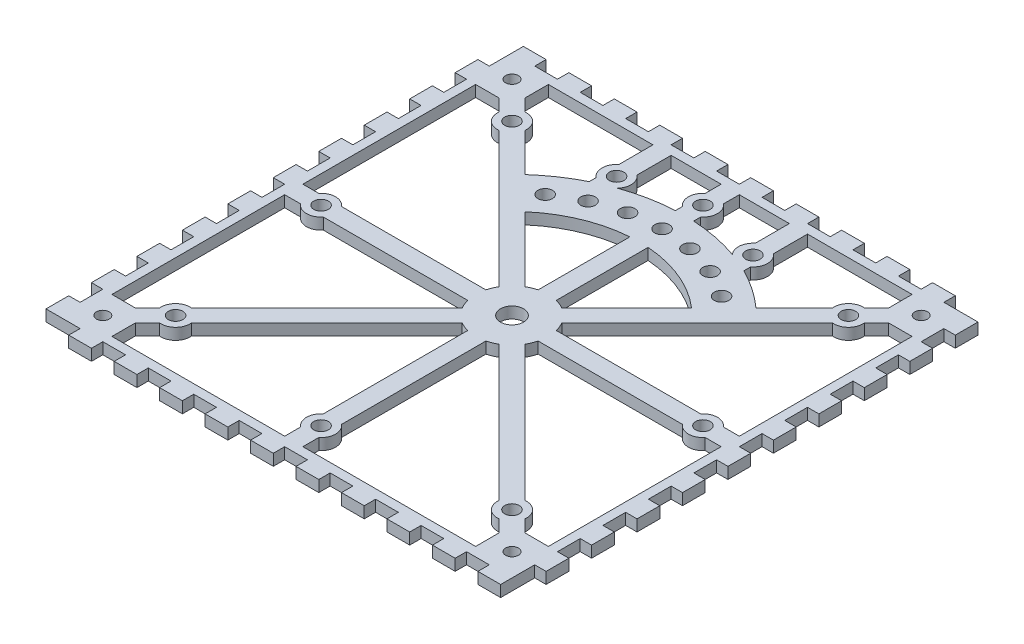
from build123d import *

# Parameters (mm, degrees)
SKETCH1_R           = 2.55
SKETCH1_R_2         = 1.6
SKETCH1_R_3         = 1.4
BOSS_EXTRUDE1_DEPTH = 2.5


with BuildPart() as part:
    # Sketch1 → Boss-Extrude1 (new body)
    with BuildSketch(Plane(origin=(0, 0, 0), x_dir=(1, 0, 0), z_dir=(0, 1, 0))):
        Polygon((-50, 50), (-50, 52.5), (-45, 52.5), (-45, 50), (-40, 50), (-40, 52.5), (-35, 52.5), (-35, 50), (-30, 50), (-30, 52.5), (-25, 52.5), (-25, 50), (-20, 50), (-20, 52.5), (-15, 52.5), (-15, 50), (-10, 50), (-10, 52.5), (-5, 52.5), (-5, 50), (0, 50), (0, 52.5), (5, 52.5), (5, 50), (10, 50), (10, 52.5), (15, 52.5), (15, 50), (20, 50), (20, 52.5), (25, 52.5), (25, 50), (30, 50), (30, 52.5), (35, 52.5), (35, 50), (40, 50), (40, 52.5), (45, 52.5), (45, 50), (50, 50), (52.5, 50), (52.5, 45), (50, 45), (50, 40), (52.5, 40), (52.5, 35), (50, 35), (50, 30), (52.5, 30), (52.5, 25), (50, 25), (50, 20), (52.5, 20), (52.5, 15), (50, 15), (50, 10), (52.5, 10), (52.5, 5), (50, 5), (50, 0), (52.5, 0), (52.5, -5), (50, -5), (50, -10), (52.5, -10), (52.5, -15), (50, -15), (50, -20), (52.5, -20), (52.5, -25), (50, -25), (50, -30), (52.5, -30), (52.5, -35), (50, -35), (50, -40), (52.5, -40), (52.5, -45), (50, -45), (50, -50), (50, -52.5), (45, -52.5), (45, -50), (40, -50), (40, -52.5), (35, -52.5), (35, -50), (30, -50), (30, -52.5), (25, -52.5), (25, -50), (20, -50), (20, -52.5), (15, -52.5), (15, -50), (10, -50), (10, -52.5), (5, -52.5), (5, -50), (0, -50), (0, -52.5), (-5, -52.5), (-5, -50), (-10, -50), (-10, -52.5), (-15, -52.5), (-15, -50), (-20, -50), (-20, -52.5), (-25, -52.5), (-25, -50), (-30, -50), (-30, -52.5), (-35, -52.5), (-35, -50), (-40, -50), (-40, -52.5), (-45, -52.5), (-45, -50), (-50, -50), (-52.5, -50), (-52.5, -45), (-50, -45), (-50, -40), (-52.5, -40), (-52.5, -35), (-50, -35), (-50, -30), (-52.5, -30), (-52.5, -25), (-50, -25), (-50, -20), (-52.5, -20), (-52.5, -15), (-50, -15), (-50, -10), (-52.5, -10), (-52.5, -5), (-50, -5), (-50, 0), (-52.5, 0), (-52.5, 5), (-50, 5), (-50, 10), (-52.5, 10), (-52.5, 15), (-50, 15), (-50, 20), (-52.5, 20), (-52.5, 25), (-50, 25), (-50, 30), (-52.5, 30), (-52.5, 35), (-50, 35), (-50, 40), (-52.5, 40), (-52.5, 45), (-50, 45), align=None)
        with Locations(Location((0, 0, 0), (0, 0, 270))):
            Circle(SKETCH1_R, mode=Mode.SUBTRACT)
        with Locations(Location((37, -37, 0), (0, 0, 270))):
            Circle(SKETCH1_R_2, mode=Mode.SUBTRACT)
        with Locations(Location((-37, -37, 0), (0, 0, 270))):
            Circle(SKETCH1_R_2, mode=Mode.SUBTRACT)
        with Locations(Location((-37, 37, 0), (0, 0, 270))):
            Circle(SKETCH1_R_2, mode=Mode.SUBTRACT)
        with Locations(Location((37, 37, 0), (0, 0, 270))):
            Circle(SKETCH1_R_2, mode=Mode.SUBTRACT)
        with Locations(Location((0, 42, 0), (0, 0, 270))):
            Circle(SKETCH1_R_2, mode=Mode.SUBTRACT)
        with Locations(Location((42, 0, 0), (0, 0, 270))):
            Circle(SKETCH1_R_2, mode=Mode.SUBTRACT)
        with Locations(Location((-42, 0, 0), (0, 0, 270))):
            Circle(SKETCH1_R_2, mode=Mode.SUBTRACT)
        with Locations(Location((0, -42, 0), (0, 0, 270))):
            Circle(SKETCH1_R_2, mode=Mode.SUBTRACT)
        with Locations(Location((-45, 45, 0), (0, 0, 270))):
            Circle(SKETCH1_R_3, mode=Mode.SUBTRACT)
        with Locations(Location((45, 45, 0), (0, 0, 270))):
            Circle(SKETCH1_R_3, mode=Mode.SUBTRACT)
        with Locations(Location((-45, -45, 0), (0, 0, 270))):
            Circle(SKETCH1_R_3, mode=Mode.SUBTRACT)
        with Locations(Location((45, -45, 0), (0, 0, 270))):
            Circle(SKETCH1_R_3, mode=Mode.SUBTRACT)
        with Locations(Location((-15, 38, 0), (0, 0, 270))):
            Circle(SKETCH1_R_2, mode=Mode.SUBTRACT)
        with Locations(Location((15, 38, 0), (0, 0, 270))):
            Circle(SKETCH1_R_2, mode=Mode.SUBTRACT)
        with Locations(Location((0, 33, 0), (0, 0, 270))):
            Circle(SKETCH1_R_2, mode=Mode.SUBTRACT)
        with Locations(Location((6.861085797, 32.278870824, 0), (0, 0, 270))):
            Circle(SKETCH1_R_2, mode=Mode.SUBTRACT)
        with Locations(Location((13.422309222, 30.147000102, 0), (0, 0, 270))):
            Circle(SKETCH1_R_2, mode=Mode.SUBTRACT)
        with Locations(Location((19.396913326, 26.697560814, 0), (0, 0, 270))):
            Circle(SKETCH1_R_2, mode=Mode.SUBTRACT)
        with Locations(Location((-19.396913326, 26.697560814, 0), (0, 0, 270))):
            Circle(SKETCH1_R_2, mode=Mode.SUBTRACT)
        with Locations(Location((-13.422309221, 30.147000102, 0), (0, 0, 270))):
            Circle(SKETCH1_R_2, mode=Mode.SUBTRACT)
        with Locations(Location((-6.861085797, 32.278870824, 0), (0, 0, 270))):
            Circle(SKETCH1_R_2, mode=Mode.SUBTRACT)
        with BuildLine():
            Line((-40, 48), (-17, 48))
            Line((-17, 48), (-17, 40.497999199))
            ThreePointArc((-17, 40.497999199), (-18.2, 38), (-17, 35.502000801))
            Line((-17, 35.502000801), (-17, 33.985290936))
            ThreePointArc((-17, 33.985290936), (-21.402484999, 31.399580186), (-25.418602168, 28.247029292))
            Line((-25.418602168, 28.247029292), (-33.819434264, 36.647861389))
            ThreePointArc((-33.819434264, 36.647861389), (-34.7372583, 39.2627417), (-37.352138611, 40.180565736))
            Line((-37.352138611, 40.180565736), (-40, 42.828427125))
            Line((-40, 42.828427125), (-40, 48))
        make_face(mode=Mode.SUBTRACT)
        with BuildLine():
            Line((-48, 40), (-48, 2))
            Line((-48, 2), (-44.497999199, 2))
            ThreePointArc((-44.497999199, 2), (-42, 3.2), (-39.502000801, 2))
            Line((-39.502000801, 2), (-7.745966692, 2))
            ThreePointArc((-7.745966692, 2), (-7.39103626, 3.061467459), (-6.891439137, 4.063012013))
            Line((-6.891439137, 4.063012013), (-36.647861389, 33.819434264))
            ThreePointArc((-36.647861389, 33.819434264), (-39.2627417, 34.7372583), (-40.180565736, 37.352138611))
            Line((-40.180565736, 37.352138611), (-42.828427125, 40))
            Line((-42.828427125, 40), (-48, 40))
        make_face(mode=Mode.SUBTRACT)
        with BuildLine():
            Line((-40, -48), (-2, -48))
            Line((-2, -48), (-2, -44.497999199))
            ThreePointArc((-2, -44.497999199), (-3.2, -42), (-2, -39.502000801))
            Line((-2, -39.502000801), (-2, -7.745966692))
            ThreePointArc((-2, -7.745966692), (-3.061467459, -7.39103626), (-4.063012013, -6.891439137))
            Line((-4.063012013, -6.891439137), (-33.819434264, -36.647861389))
            ThreePointArc((-33.819434264, -36.647861389), (-34.7372583, -39.2627417), (-37.352138611, -40.180565736))
            Line((-37.352138611, -40.180565736), (-40, -42.828427125))
            Line((-40, -42.828427125), (-40, -48))
        make_face(mode=Mode.SUBTRACT)
        with BuildLine():
            Line((48, 40), (48, 2))
            Line((48, 2), (44.497999199, 2))
            ThreePointArc((44.497999199, 2), (42, 3.2), (39.502000801, 2))
            Line((39.502000801, 2), (7.745966692, 2))
            ThreePointArc((7.745966692, 2), (7.39103626, 3.061467459), (6.891439137, 4.063012013))
            Line((6.891439137, 4.063012013), (36.647861389, 33.819434264))
            ThreePointArc((36.647861389, 33.819434264), (39.2627417, 34.7372583), (40.180565736, 37.352138611))
            Line((40.180565736, 37.352138611), (42.828427125, 40))
            Line((42.828427125, 40), (48, 40))
        make_face(mode=Mode.SUBTRACT)
        with BuildLine():
            Line((48, -2), (48, -40))
            Line((48, -40), (42.828427125, -40))
            Line((42.828427125, -40), (40.180565736, -37.352138611))
            ThreePointArc((40.180565736, -37.352138611), (39.2627417, -34.7372583), (36.647861389, -33.819434264))
            Line((36.647861389, -33.819434264), (6.891439137, -4.063012013))
            ThreePointArc((6.891439137, -4.063012013), (7.39103626, -3.061467459), (7.745966692, -2))
            Line((7.745966692, -2), (39.502000801, -2))
            ThreePointArc((39.502000801, -2), (42, -3.2), (44.497999199, -2))
            Line((44.497999199, -2), (48, -2))
        make_face(mode=Mode.SUBTRACT)
        with BuildLine():
            Line((40, -42.828427125), (37.352138611, -40.180565736))
            ThreePointArc((37.352138611, -40.180565736), (34.7372583, -39.2627417), (33.819434264, -36.647861389))
            Line((33.819434264, -36.647861389), (4.063012013, -6.891439137))
            ThreePointArc((4.063012013, -6.891439137), (3.061467459, -7.39103626), (2, -7.745966692))
            Line((2, -7.745966692), (2, -39.502000801))
            ThreePointArc((2, -39.502000801), (3.2, -42), (2, -44.497999199))
            Line((2, -44.497999199), (2, -48))
            Line((2, -48), (40, -48))
            Line((40, -48), (40, -42.828427125))
        make_face(mode=Mode.SUBTRACT)
        with BuildLine():
            Line((-48, -2), (-44.497999199, -2))
            ThreePointArc((-44.497999199, -2), (-42, -3.2), (-39.502000801, -2))
            Line((-39.502000801, -2), (-7.745966692, -2))
            ThreePointArc((-7.745966692, -2), (-7.39103626, -3.061467459), (-6.891439137, -4.063012013))
            Line((-6.891439137, -4.063012013), (-36.647861389, -33.819434264))
            ThreePointArc((-36.647861389, -33.819434264), (-39.2627417, -34.7372583), (-40.180565736, -37.352138611))
            Line((-40.180565736, -37.352138611), (-42.828427125, -40))
            Line((-42.828427125, -40), (-48, -40))
            Line((-48, -40), (-48, -2))
        make_face(mode=Mode.SUBTRACT)
        with BuildLine():
            Line((2, 48), (2, 44.497999199))
            ThreePointArc((2, 44.497999199), (3.2, 42), (2, 39.502000801))
            Line((2, 39.502000801), (2, 37.947331922))
            ThreePointArc((2, 37.947331922), (7.397643577, 37.272977739), (12.643700473, 35.834855076))
            ThreePointArc((12.643700473, 35.834855076), (11.809300285, 38.243793623), (13, 40.497999199))
            Line((13, 40.497999199), (13, 48))
            Line((13, 48), (2, 48))
        make_face(mode=Mode.SUBTRACT)
        with BuildLine():
            Line((-2, 39.502000801), (-2, 37.947331922))
            ThreePointArc((-2, 37.947331922), (-7.397643577, 37.272977739), (-12.643700473, 35.834855076))
            ThreePointArc((-12.643700473, 35.834855076), (-11.809300285, 38.243793623), (-13, 40.497999199))
            Line((-13, 40.497999199), (-13, 48))
            Line((-13, 48), (-2, 48))
            Line((-2, 48), (-2, 44.497999199))
            ThreePointArc((-2, 44.497999199), (-3.2, 42), (-2, 39.502000801))
        make_face(mode=Mode.SUBTRACT)
        with BuildLine():
            Line((33.819434264, 36.647861389), (25.418602168, 28.247029292))
            ThreePointArc((25.418602168, 28.247029292), (21.402484999, 31.399580186), (17, 33.985290936))
            Line((17, 33.985290936), (17, 35.502000801))
            ThreePointArc((17, 35.502000801), (18.2, 38), (17, 40.497999199))
            Line((17, 40.497999199), (17, 48))
            Line((17, 48), (40, 48))
            Line((40, 48), (40, 42.828427125))
            Line((40, 42.828427125), (37.352138611, 40.180565736))
            ThreePointArc((37.352138611, 40.180565736), (34.7372583, 39.2627417), (33.819434264, 36.647861389))
        make_face(mode=Mode.SUBTRACT)
        with BuildLine():
            Line((-18.334204096, 21.162631221), (-4.063012013, 6.891439137))
            ThreePointArc((-4.063012013, 6.891439137), (-3.061467459, 7.39103626), (-2, 7.745966692))
            Line((-2, 7.745966692), (-2, 27.928480088))
            ThreePointArc((-2, 27.928480088), (-10.715136106, 25.86862691), (-18.334204096, 21.162631221))
        make_face(mode=Mode.SUBTRACT)
        with BuildLine():
            Line((18.334204096, 21.16263122), (4.063012013, 6.891439137))
            ThreePointArc((4.063012013, 6.891439137), (3.061467459, 7.39103626), (2, 7.745966692))
            Line((2, 7.745966692), (2, 27.928480088))
            ThreePointArc((2, 27.928480088), (10.715136106, 25.86862691), (18.334204096, 21.16263122))
        make_face(mode=Mode.SUBTRACT)
    extrude(amount=BOSS_EXTRUDE1_DEPTH)


solid = part.part
